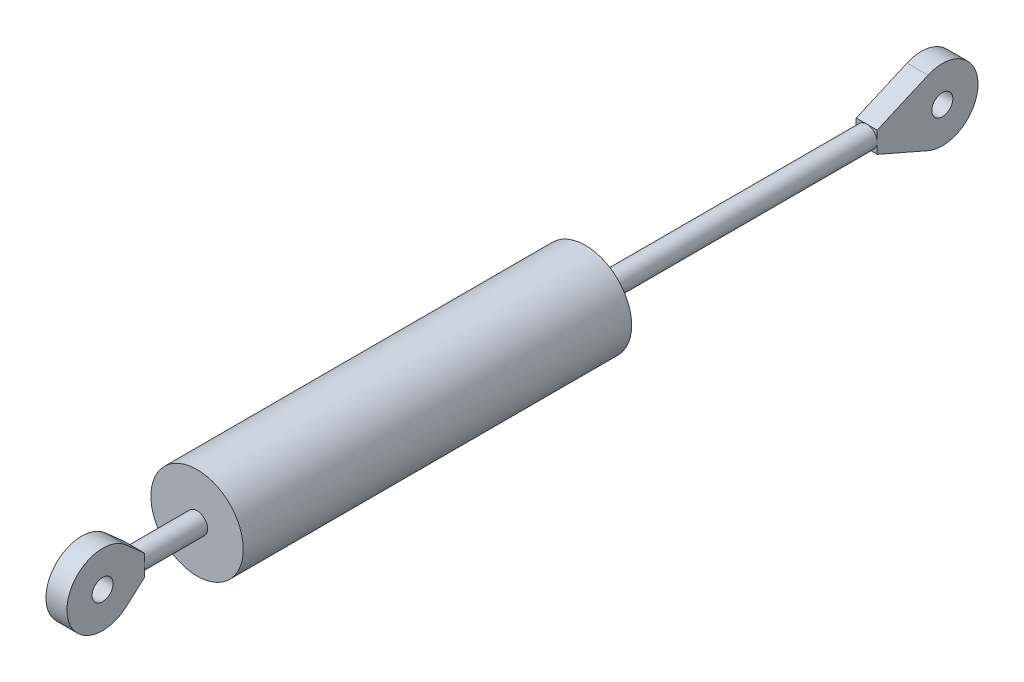
from build123d import *

# Parameters (mm, degrees)
SKETCH1_W                = 92.5
SKETCH1_H                = 11
SKETCH2_R                = 2.5
BOSS_EXTRUDE1_DEPTH      = 15
BOSS_EXTRUDE2_DEPTH      = 2.5
BOSS_EXTRUDE2_DEPTH_BACK = 2.5
SKETCH3_R                = 2.5
BOSS_EXTRUDE3_START      = 67
SKETCH4_R                = 2.5
BOSS_EXTRUDE3_DEPTH      = 67
BOSS_EXTRUDE4_DEPTH      = 2.5
BOSS_EXTRUDE4_DEPTH_BACK = 2.5
SKETCH5_R                = 2.5


with BuildPart() as part:
    # Sketch1 → Revolve1 (revolve)
    with BuildSketch(Plane(origin=(0, 0, 0), x_dir=(0, 0, -1), z_dir=(1, 0, 0))):
        with Locations((0, 5.5)):
            Rectangle(SKETCH1_W, SKETCH1_H)
    revolve(axis=Axis((0, 0, 46.25), (0, 0, -1)))

    # Sketch2 → Boss-Extrude1 (add)
    with BuildSketch(Plane.XY.offset(46.25)):
        Circle(SKETCH2_R)
    extrude(amount=BOSS_EXTRUDE1_DEPTH)

    # Sketch3 → Boss-Extrude2 (add, two sides: drawn at the far end of the back side and taken through both)
    with BuildSketch(Plane(origin=(0, 0, 0), x_dir=(0, 0, -1), z_dir=(1, 0, 0)).offset(-BOSS_EXTRUDE2_DEPTH_BACK)):
        with BuildLine():
            Line((-61.25, 2.5), (-65.616190379, 6.364761516))
            ThreePointArc((-65.616190379, 6.364761516), (-79.75, 0), (-65.616190379, -6.364761516))
            Line((-65.616190379, -6.364761516), (-61.25, -2.5))
            Line((-61.25, -2.5), (-61.25, 2.5))
        make_face()
        with Locations((-71.25, 0)):
            Circle(SKETCH3_R, mode=Mode.SUBTRACT)
    extrude(amount=BOSS_EXTRUDE2_DEPTH + BOSS_EXTRUDE2_DEPTH_BACK)

    # Sketch4 → Boss-Extrude3 (add)
    with BuildSketch(Plane(origin=(0, 0, -46.25), x_dir=(-1, 0, 0), z_dir=(0, 0, -1)).offset(BOSS_EXTRUDE3_START)):
        Circle(SKETCH4_R)
    extrude(amount=-BOSS_EXTRUDE3_DEPTH)

    # Sketch5 → Boss-Extrude4 (add, two sides: drawn at the far end of the back side and taken through both)
    with BuildSketch(Plane(origin=(0, 0, 0), x_dir=(0, 0, -1), z_dir=(1, 0, 0)).offset(-BOSS_EXTRUDE4_DEPTH_BACK)):
        with BuildLine():
            Line((113.25, 2.5), (125.34486024, 7.788133487))
            ThreePointArc((125.34486024, 7.788133487), (137.25, 0), (125.34486024, -7.788133487))
            Line((125.34486024, -7.788133487), (113.25, -2.5))
            Line((113.25, -2.5), (113.25, 2.5))
        make_face()
        with Locations((128.75, 0)):
            Circle(SKETCH5_R, mode=Mode.SUBTRACT)
    extrude(amount=BOSS_EXTRUDE4_DEPTH + BOSS_EXTRUDE4_DEPTH_BACK)


solid = part.part
